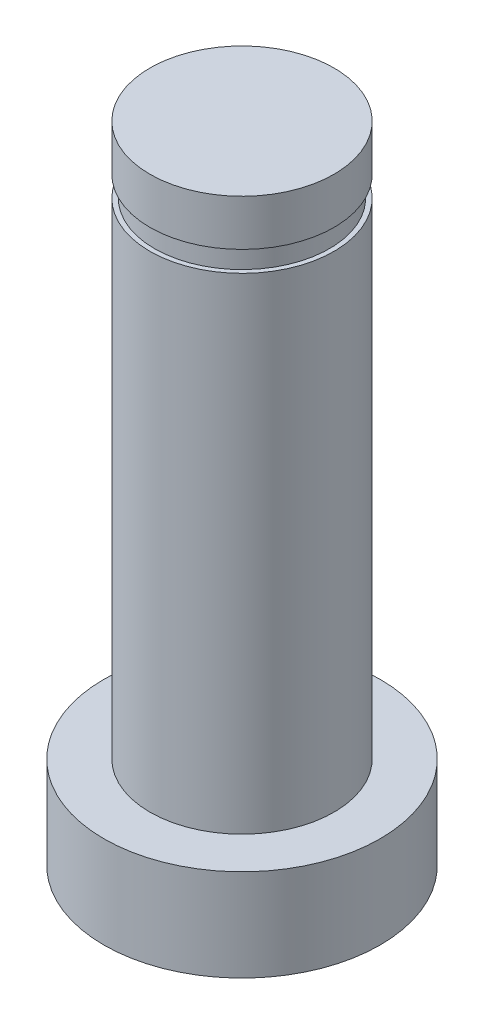
from build123d import *

# Parameters (mm, degrees)
SKETCH_1_R      = 6
EXTRUDE_1_DEPTH = 4
SKETCH_2_R      = 4
EXTRUDE_2_DEPTH = 21.1
SKETCH_3_R      = 3.8
EXTRUDE_3_DEPTH = 0.9
SKETCH_4_R      = 4
EXTRUDE_4_DEPTH = 2


with BuildPart() as part:
    # 草图1 → 凸台-拉伸1 (new body)
    with BuildSketch(Plane(origin=(0, 0, 0), x_dir=(1, 0, 0), z_dir=(0, 1, 0))):
        with Locations(Location((0, 0, 0), (0, 0, 270))):
            Circle(SKETCH_1_R)
    extrude(amount=EXTRUDE_1_DEPTH)

    # 草图2 → 凸台-拉伸2 (add)
    with BuildSketch(Plane(origin=(0, 4, 0), x_dir=(1, 0, 0), z_dir=(0, 1, 0))):
        with Locations(Location((0, 0, 0), (0, 0, 270))):
            Circle(SKETCH_2_R)
    extrude(amount=EXTRUDE_2_DEPTH)

    # 草图3 → 凸台-拉伸3 (add)
    with BuildSketch(Plane(origin=(0, 25.1, 0), x_dir=(1, 0, 0), z_dir=(0, 1, 0))):
        with Locations(Location((0, 0, 0), (0, 0, 270))):
            Circle(SKETCH_3_R)
    extrude(amount=EXTRUDE_3_DEPTH)

    # 草图4 → 凸台-拉伸4 (add)
    with BuildSketch(Plane(origin=(0, 26, 0), x_dir=(1, 0, 0), z_dir=(0, 1, 0))):
        with Locations(Location((0, 0, 0), (0, 0, 270))):
            Circle(SKETCH_4_R)
    extrude(amount=EXTRUDE_4_DEPTH)


solid = part.part
